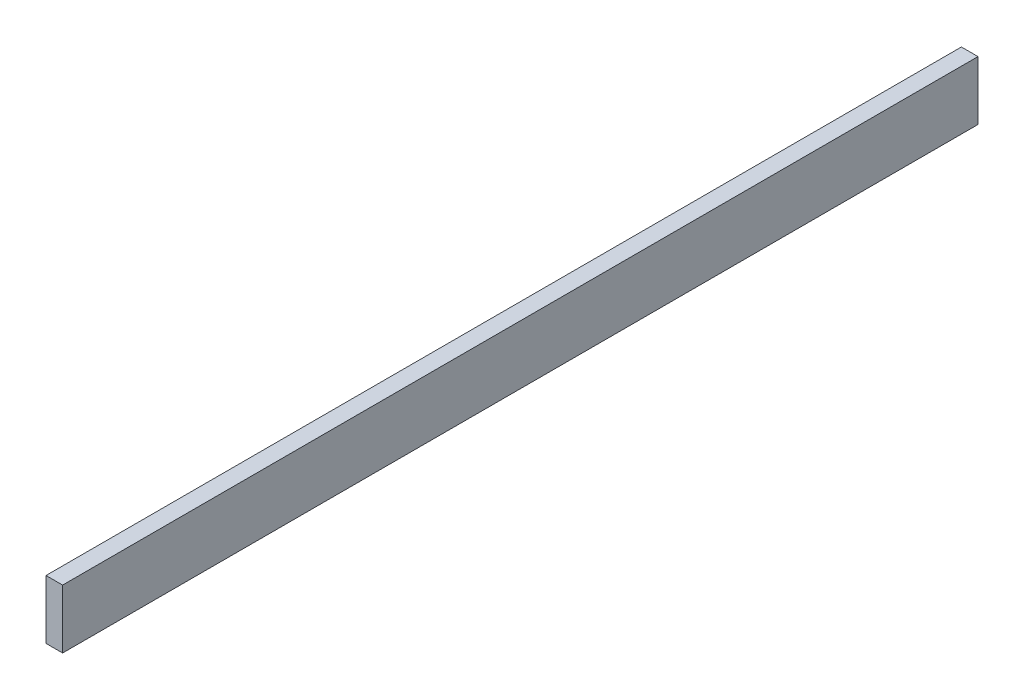
from build123d import *

# Parameters (mm, degrees)
SKETCH1_W                             = 12.7
SKETCH1_H                             = 45
DET_MOTORLU_RAY_GOVDE_45X12_7_1_DEPTH = 700


with BuildPart() as part:
    # Sketch1 → DET_MOTORLU_RAY_govde_45x12.7_1 (new body)
    with BuildSketch(Plane.XY):
        with Locations((720.35, 1549.5)):
            Rectangle(SKETCH1_W, SKETCH1_H)
    extrude(amount=-DET_MOTORLU_RAY_GOVDE_45X12_7_1_DEPTH)


solid = part.part
